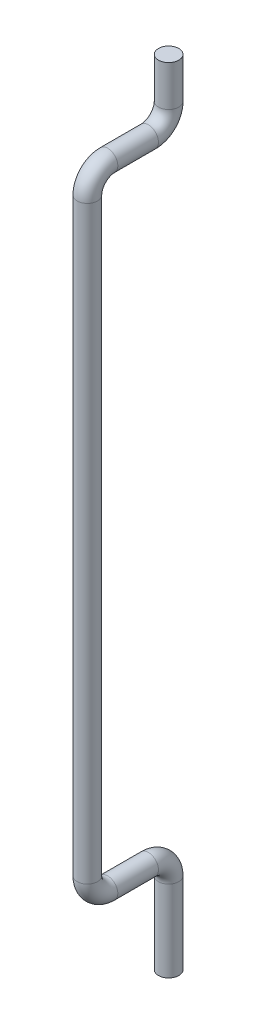
from build123d import *

# Parameters (mm, degrees)
SKETCH2_R = 0.5


with BuildPart() as part:
    # Sweep1: sweep along a path in Sketch1
    with BuildLine(Plane(origin=(0, 0, 0), x_dir=(0, 0, -1), z_dir=(1, 0, 0))) as sweep1_path:
        Line((13.22, -2), (13.22, 2))
        ThreePointArc((13.22, 2), (12.927106781, 2.707106781), (12.22, 3))
        Line((12.22, 3), (10.22, 3))
        ThreePointArc((10.22, 3), (9.512893219, 3.292893219), (9.22, 4))
        Line((9.22, 4), (9.22, 33))
        ThreePointArc((9.22, 33), (9.512893219, 33.707106781), (10.22, 34))
        Line((10.22, 34), (12.22, 34))
        ThreePointArc((12.22, 34), (12.927106781, 34.292893219), (13.22, 35))
        Line((13.22, 35), (13.22, 37))
    # Sketch2 → Sweep1 (sweep)
    with BuildSketch(Plane(origin=(0, -2, 0), x_dir=(1, 0, 0), z_dir=(0, 1, 0))):
        with Locations((0, 13.22)):
            Circle(SKETCH2_R)
    sweep(path=sweep1_path.line)


solid = part.part
